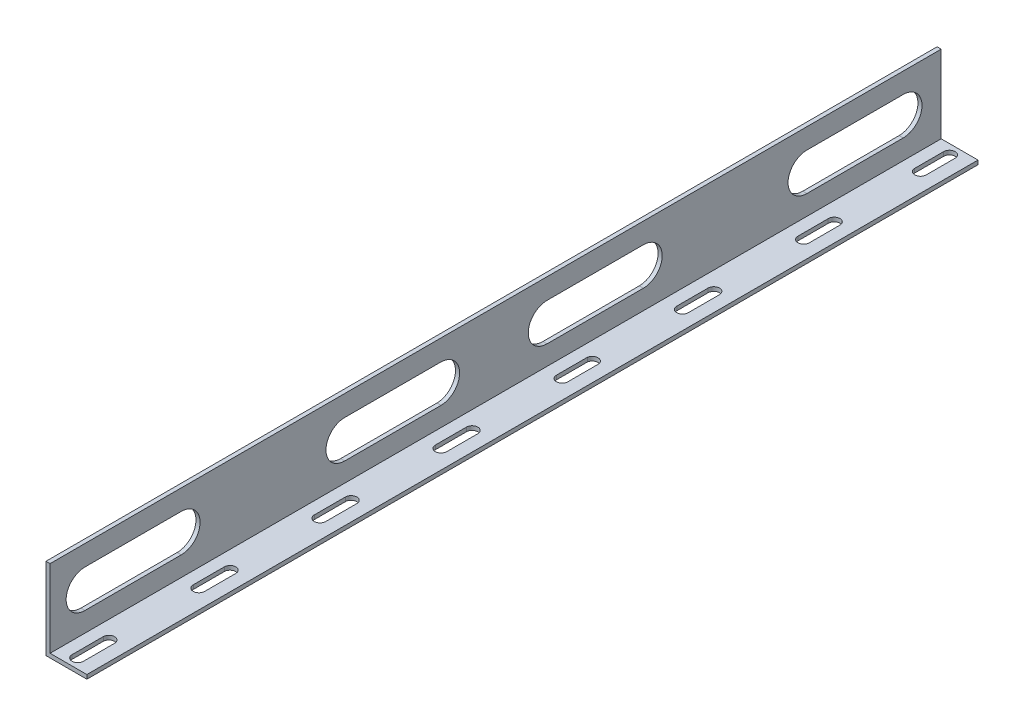
from build123d import *

# Parameters (mm, degrees)
BOSS_EXTRUDE1_DEPTH = 545
CUT_EXTRUDE2_DEPTH  = 10
CUT_EXTRUDE3_DEPTH  = 10


with BuildPart() as part:
    # Sketch1 → Boss-Extrude1 (new body)
    with BuildSketch(Plane.XY):
        Polygon((-9.451520251, 23.80952381), (-9.451520251, -26.19047619), (15.548479749, -26.19047619), (15.548479749, -23.69047619), (-6.951520251, -23.69047619), (-6.951520251, 23.80952381), align=None)
    extrude(amount=BOSS_EXTRUDE1_DEPTH)

    # Sketch3 → Cut-Extrude2 (cut)
    with BuildSketch(Plane(origin=(0, -23.69047619, 0), x_dir=(1, 0, 0), z_dir=(0, 1, 0))):
        with BuildLine():
            Line((0.57076558, -242.790014276), (0.57076558, -223.790014276))
            ThreePointArc((0.57076558, -223.790014276), (4.07076558, -220.926188945), (7.57076558, -223.790014276))
            Line((7.57076558, -223.790014276), (7.57076558, -242.790014276))
            ThreePointArc((7.57076558, -242.790014276), (4.07076558, -246.37195288), (0.57076558, -242.790014276))
        make_face()
        with BuildLine():
            Line((0.807679204, -169.35276274), (0.808591774, -150.352762761))
            ThreePointArc((0.808591774, -150.352762761), (4.309142051, -146.853313591), (7.808591221, -150.353863868))
            Line((7.808591221, -150.353863868), (7.809609956, -169.355340241))
            ThreePointArc((7.809609956, -169.355340241), (4.307302192, -173.000725763), (0.807679204, -169.35276274))
        make_face()
        with BuildLine():
            Line((0.583868221, -24), (0.583868221, -6))
            ThreePointArc((0.583868221, -6), (4.083868221, -2.5), (7.583868221, -6))
            Line((7.583868221, -6), (7.583868221, -24))
            ThreePointArc((7.583868221, -24), (4.083868221, -27.222249808), (0.583868221, -24))
        make_face()
        with BuildLine():
            Line((0.55068367, -316.822260412), (0.55068367, -297.822260412))
            ThreePointArc((0.55068367, -297.822260412), (4.05068367, -294.370676122), (7.55068367, -297.822260412))
            Line((7.55068367, -297.822260412), (7.55068367, -316.822260412))
            ThreePointArc((7.55068367, -316.822260412), (4.05068367, -320.404199017), (0.55068367, -316.822260412))
        make_face()
        with BuildLine():
            Line((0.548436659, -390.854506502), (0.548436659, -371.854506502))
            ThreePointArc((0.548436659, -371.854506502), (4.048436659, -368.402922212), (7.548436659, -371.854506502))
            Line((7.548436659, -371.854506502), (7.548436659, -390.854506502))
            ThreePointArc((7.548436659, -390.854506502), (4.048436659, -394.436445107), (0.548436659, -390.854506502))
        make_face()
        with BuildLine():
            Line((0.543910271, -464.886752452), (0.543910271, -445.886752452))
            ThreePointArc((0.543910271, -445.886752452), (4.043910271, -442.435168162), (7.543910271, -445.886752452))
            Line((7.543910271, -445.886752452), (7.543910271, -464.886752452))
            ThreePointArc((7.543910271, -464.886752452), (4.043910271, -468.468691057), (0.543910271, -464.886752452))
        make_face()
        with BuildLine():
            Line((0.482021973, -538.918998588), (0.482021973, -519.918998588))
            ThreePointArc((0.482021973, -519.918998588), (3.982021973, -516.467414298), (7.482021973, -519.918998588))
            Line((7.482021973, -519.918998588), (7.482021973, -538.918998588))
            ThreePointArc((7.482021973, -538.918998588), (3.982021973, -542.500937193), (0.482021973, -538.918998588))
        make_face()
        with BuildLine():
            Line((0.799787986, -95.209226687), (0.798633115, -76.892344291))
            ThreePointArc((0.798633115, -76.892344291), (4.297807626, -73.191635658), (7.798672507, -76.890745244))
            Line((7.798672507, -76.890745244), (7.801718738, -95.211804188))
            ThreePointArc((7.801718738, -95.211804188), (4.299410974, -98.857189711), (0.799787986, -95.209226687))
        make_face()
    extrude(amount=-CUT_EXTRUDE2_DEPTH, mode=Mode.SUBTRACT)

    # Sketch2 → Cut-Extrude3 (cut)
    with BuildSketch(Plane(origin=(-6.951520251, 0, 0), x_dir=(0, 0, -1), z_dir=(1, 0, 0))):
        with BuildLine():
            Line((-523.677073705, 11.34825395), (-464.779022926, 11.34825395))
            ThreePointArc((-464.779022926, 11.34825395), (-453.273357193, -0.157411783), (-464.779022926, -11.663077517))
            Line((-464.779022926, -11.663077517), (-523.677073705, -11.663077517))
            ThreePointArc((-523.677073705, -11.663077517), (-535.182739439, -0.157411783), (-523.677073705, 11.34825395))
        make_face()
        with BuildLine():
            Line((-364.779022926, 11.087774361), (-305.880972148, 11.087774361))
            ThreePointArc((-305.880972148, 11.087774361), (-294.548021848, -0.417891372), (-305.880972148, -11.923557106))
            Line((-305.880972148, -11.923557106), (-364.779022926, -11.923557106))
            ThreePointArc((-364.779022926, -11.923557106), (-376.28468866, -0.417891372), (-364.779022926, 11.087774361))
        make_face()
        with BuildLine():
            Line((-241.055003683, 11.260273997), (-182.156952904, 11.260273997))
            ThreePointArc((-182.156952904, 11.260273997), (-170.65128717, -0.245391736), (-182.156952904, -11.75105747))
            Line((-182.156952904, -11.75105747), (-241.055003683, -11.75105747))
            ThreePointArc((-241.055003683, -11.75105747), (-252.560669416, -0.245391736), (-241.055003683, 11.260273997))
        make_face()
        with BuildLine():
            Line((-82.156952904, 11.402162448), (-23.258902125, 11.402162448))
            ThreePointArc((-23.258902125, 11.402162448), (-11.753236392, -0.103503285), (-23.258902125, -11.609169019))
            Line((-23.258902125, -11.609169019), (-82.156952904, -11.609169019))
            ThreePointArc((-82.156952904, -11.609169019), (-93.662618637, -0.103503285), (-82.156952904, 11.402162448))
        make_face()
    extrude(amount=-CUT_EXTRUDE3_DEPTH, mode=Mode.SUBTRACT)


solid = part.part
